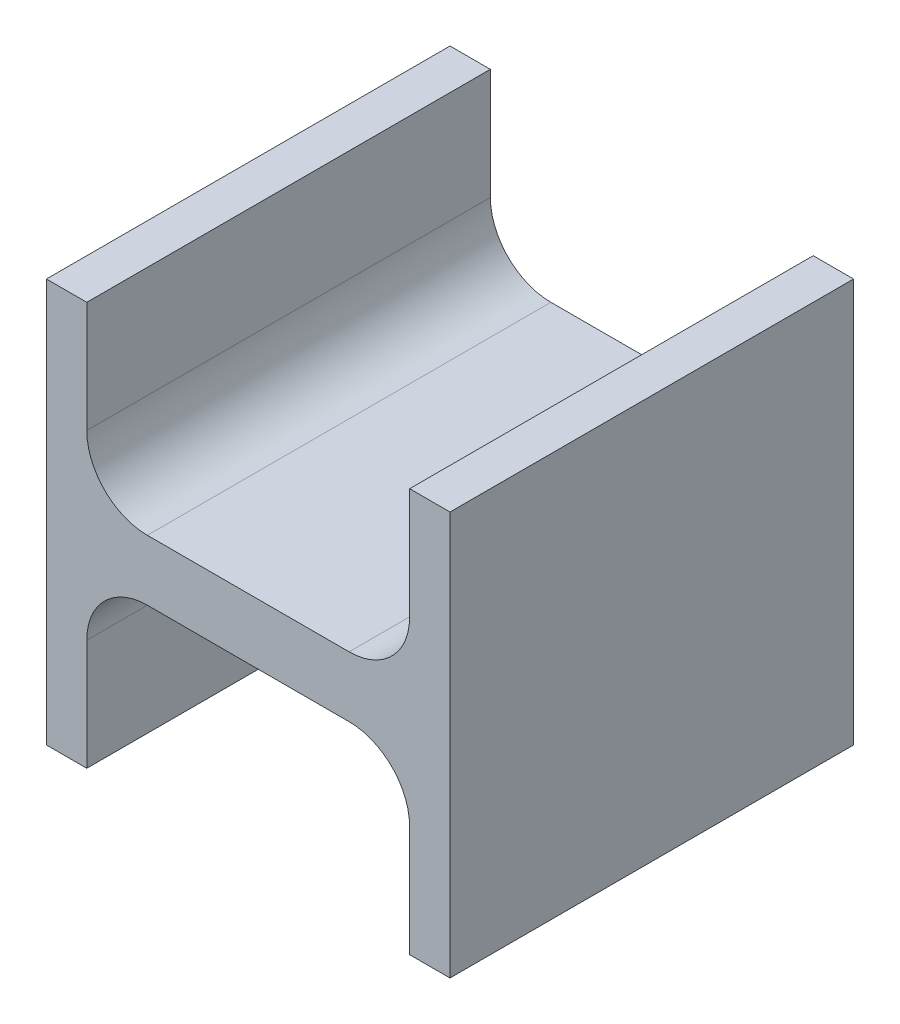
from build123d import *

# Parameters (mm, degrees)
BOSS_EXTRUDE2_DEPTH = 20
FILLET1_R           = 3
FILLET2_R           = 3


with BuildPart() as part:
    # Sketch2 → Boss-Extrude2 (new body)
    with BuildSketch(Plane.XY):
        Polygon((-10, -10), (-8, -10), (-8, -1.5), (8, -1.5), (8, -10), (10, -10), (10, 10), (8, 10), (8, 1.5), (-8, 1.5), (-8, 10), (-10, 10), align=None)
    extrude(amount=BOSS_EXTRUDE2_DEPTH)

    # Fillet1
    fillet1_edges = [part.edges().sort_by_distance(p)[0] for p in [
        (-8, 1.5, 10),
    ]]
    fillet(fillet1_edges, radius=FILLET1_R)

    # Fillet2
    fillet2_edges = [part.edges().sort_by_distance(p)[0] for p in [
        (8, 1.5, 10),
        (8, -1.5, 10),
        (-8, -1.5, 10),
    ]]
    fillet(fillet2_edges, radius=FILLET2_R)


solid = part.part
